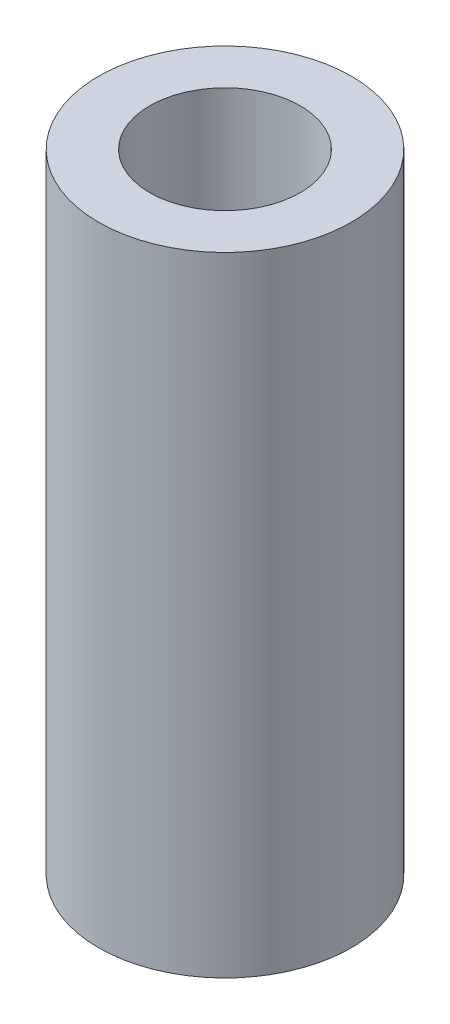
from build123d import *

# Parameters (mm, degrees)
SKETCH1_R           = 3.2
BOSS_EXTRUDE1_DEPTH = 15.9
SKETCH2_R           = 1.905
CUT_EXTRUDE1_DEPTH  = 17.531485112


with BuildPart() as part:
    # Sketch1 → Boss-Extrude1 (new body)
    with BuildSketch(Plane(origin=(0, 0, 0), x_dir=(1, 0, 0), z_dir=(0, 1, 0))):
        with Locations(Location((0, 0, 0), (0, 0, 270))):
            Circle(SKETCH1_R)
    extrude(amount=BOSS_EXTRUDE1_DEPTH)

    # Sketch2 → Cut-Extrude1 (cut, through all)
    with BuildSketch(Plane(origin=(0, 15.9, 0), x_dir=(1, 0, 0), z_dir=(0, 1, 0))):
        with Locations(Location((0, 0, 0), (0, 0, 270))):
            Circle(SKETCH2_R)
    extrude(amount=-CUT_EXTRUDE1_DEPTH, mode=Mode.SUBTRACT)


solid = part.part
